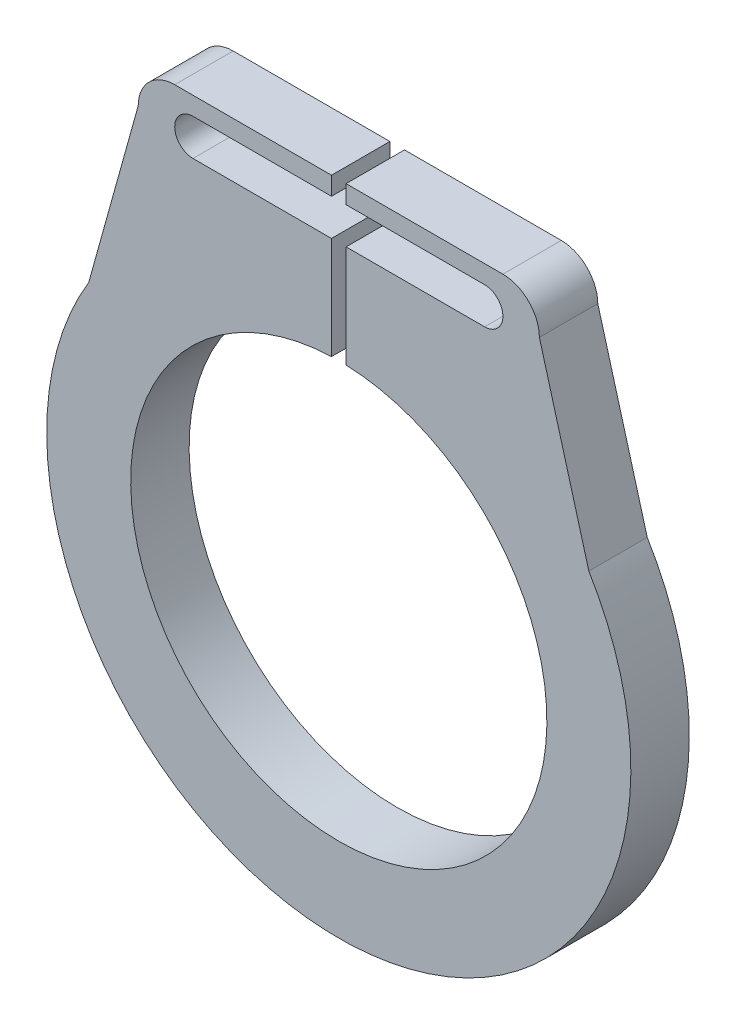
from build123d import *

# Parameters (mm, degrees)
BOSS_EXTRUDE2_DEPTH = 0.4


with BuildPart() as part:
    # Sketch1 → Boss-Extrude2 (new body)
    with BuildSketch(Plane.XY):
        with BuildLine():
            ThreePointArc((0.05, 1.424122537), (0, -1.425), (-0.05, 1.424122537))
            Line((-0.05, 1.424122537), (-0.05, 2.125))
            Line((-0.05, 2.125), (-0.998523005, 2.125))
            ThreePointArc((-0.998523005, 2.125), (-1.123523005, 2.25), (-0.998523005, 2.375))
            Line((-0.998523005, 2.375), (-0.05, 2.375))
            Line((-0.05, 2.375), (-0.05, 2.5))
            Line((-0.05, 2.5), (-1.123523005, 2.5))
            ThreePointArc((-1.123523005, 2.5), (-1.3002997, 2.426776695), (-1.373523005, 2.25))
            Line((-1.373523005, 2.25), (-1.712208735, 1.033605944))
            ThreePointArc((-1.712208735, 1.033605944), (0, -2), (1.712208735, 1.033605944))
            Line((1.712208735, 1.033605944), (1.373523005, 2.25))
            ThreePointArc((1.373523005, 2.25), (1.3002997, 2.426776695), (1.123523005, 2.5))
            Line((1.123523005, 2.5), (0.05, 2.5))
            Line((0.05, 2.5), (0.05, 2.375))
            Line((0.05, 2.375), (0.998523005, 2.375))
            ThreePointArc((0.998523005, 2.375), (1.123523005, 2.25), (0.998523005, 2.125))
            Line((0.998523005, 2.125), (0.05, 2.125))
            Line((0.05, 2.125), (0.05, 1.424122537))
        make_face()
    extrude(amount=BOSS_EXTRUDE2_DEPTH)


solid = part.part
